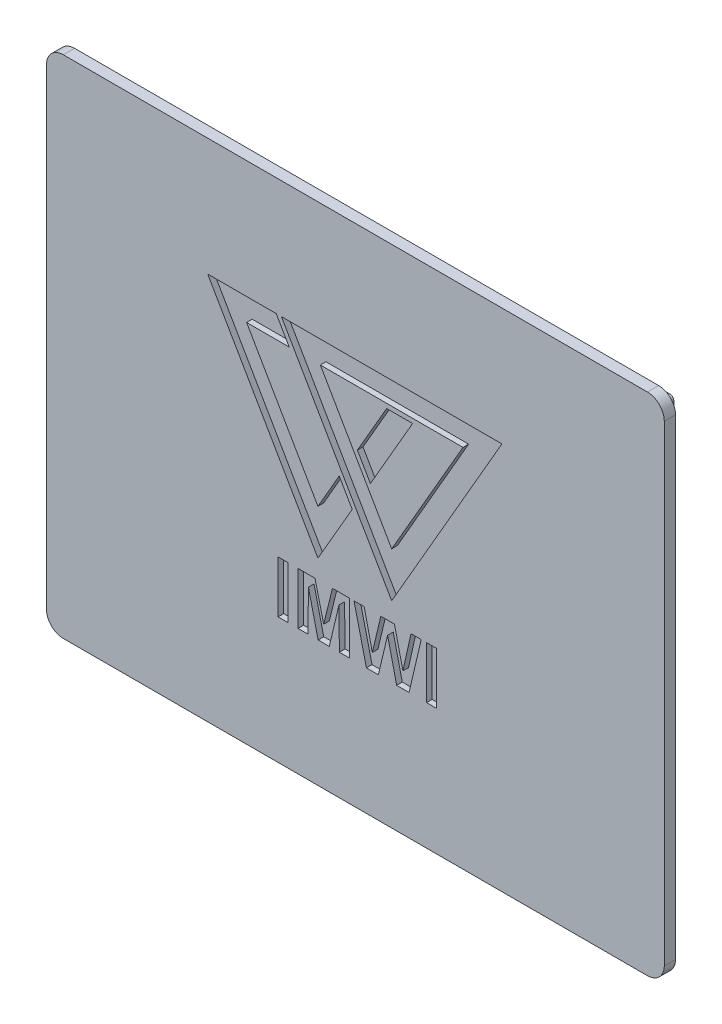
from build123d import *

# Parameters (mm, degrees)
SKETCH1_W           = 103
SKETCH1_H           = 83
BOSS_EXTRUDE1_DEPTH = 2
BOSS_EXTRUDE3_DEPTH = 2
CUT_EXTRUDE1_DEPTH  = 1
SKETCH5_W           = 1.778066781
SKETCH5_H           = 9.245947266
SKETCH5_W_2         = 1.778066782
CUT_EXTRUDE2_DEPTH  = 1


with BuildPart() as part:
    # Sketch1 → Boss-Extrude1 (new body)
    with BuildSketch(Plane.XY):
        with BuildLine():
            Line((-52.7, 42), (-52.7, -42))
            ThreePointArc((-52.7, -42), (-52.494974747, -42.494974747), (-52, -42.7))
            Line((-52, -42.7), (52, -42.7))
            ThreePointArc((52, -42.7), (52.494974747, -42.494974747), (52.7, -42))
            Line((52.7, -42), (52.7, 42))
            ThreePointArc((52.7, 42), (52.494974747, 42.494974747), (52, 42.7))
            Line((52, 42.7), (-52, 42.7))
            ThreePointArc((-52, 42.7), (-52.494974747, 42.494974747), (-52.7, 42))
        make_face()
        Rectangle(SKETCH1_W, SKETCH1_H, mode=Mode.SUBTRACT)
    extrude(amount=BOSS_EXTRUDE1_DEPTH)

    # Sketch3 → Boss-Extrude3 (add)
    with BuildSketch(Plane.XY.offset(2)):
        with BuildLine():
            Line((52, 45), (-52, 45))
            ThreePointArc((-52, 45), (-54.121320344, 44.121320344), (-55, 42))
            Line((-55, 42), (-55, -42))
            ThreePointArc((-55, -42), (-54.121320344, -44.121320344), (-52, -45))
            Line((-52, -45), (52, -45))
            ThreePointArc((52, -45), (54.121320344, -44.121320344), (55, -42))
            Line((55, -42), (55, 42))
            ThreePointArc((55, 42), (54.121320344, 44.121320344), (52, 45))
        make_face()
    extrude(amount=BOSS_EXTRUDE3_DEPTH)

    # Sketch4 → Cut-Extrude1 (cut)
    # profile 1 of 3: a face of its own
    with BuildSketch(Plane.XY.offset(4)):
        Polygon((12.961332904, 24.04515047), (-13.167559701, 24.04515047), (6.462349451, -9.95484953), (26.092258604, 24.04515047), align=None)
        Polygon((-6.239356471, 20.04515047), (6.033129674, 20.04515047), (19.164055373, 20.04515047), (6.462349451, -1.95484953), align=None, mode=Mode.SUBTRACT)
    # profile 2 of 3: a face of its own
    with BuildSketch(Plane.XY.offset(4)):
        Polygon((0.358766817, 10.216865701), (5.571249459, 19.24515047), (10.190051612, 19.24515047), (2.668167894, 6.216865701), align=None)
    # profile 3 of 3: a face of its own
    with BuildSketch(Plane.XY.offset(4)):
        Polygon((-14.091320132, 24.04515047), (-11.781919055, 20.04515047), (-19.37028217, 20.04515047), (-6.668576248, -1.95484953), (-2.874394691, 4.616865701), (-0.564993614, 0.616865701), (-6.668576248, -9.95484953), (-26.298485401, 24.04515047), align=None)
    extrude(amount=-CUT_EXTRUDE1_DEPTH, mode=Mode.SUBTRACT)

    # Sketch5 → Cut-Extrude2 (cut)
    with BuildSketch(Plane.XY.offset(4)):
        with Locations((-12.872296082, -17.930038178)):
            Rectangle(SKETCH5_W, SKETCH5_H)
        Polygon((-10.205195909, -22.553011811), (-10.205195909, -13.307064545), (-7.197299603, -13.307064545), (-5.641491169, -19.613645162), (-4.085682735, -13.307064545), (-1.077786429, -13.307064545), (-1.077786429, -22.553011811), (-2.85585321, -22.553011811), (-2.915122103, -15.274050923), (-4.650589368, -22.553011811), (-6.632392969, -22.553011811), (-8.367860234, -15.274050923), (-8.427129127, -22.553011811), align=None)
        Polygon((1.965300782, -22.553011811), (-0.24802193, -13.307064545), (1.574496521, -13.307064545), (3.01176717, -19.658096832), (4.532384699, -13.307064545), (6.958704995, -13.307064545), (8.464505301, -19.7655217), (9.898071644, -13.307064545), (11.724294401, -13.307064545), (9.551719052, -22.553011811), (7.349509256, -22.553011811), (5.738136235, -15.640777196), (4.084163698, -22.553011811), align=None)
        with Locations((13.561630075, -17.930038178)):
            Rectangle(SKETCH5_W_2, SKETCH5_H)
    extrude(amount=-CUT_EXTRUDE2_DEPTH, mode=Mode.SUBTRACT)


solid = part.part
